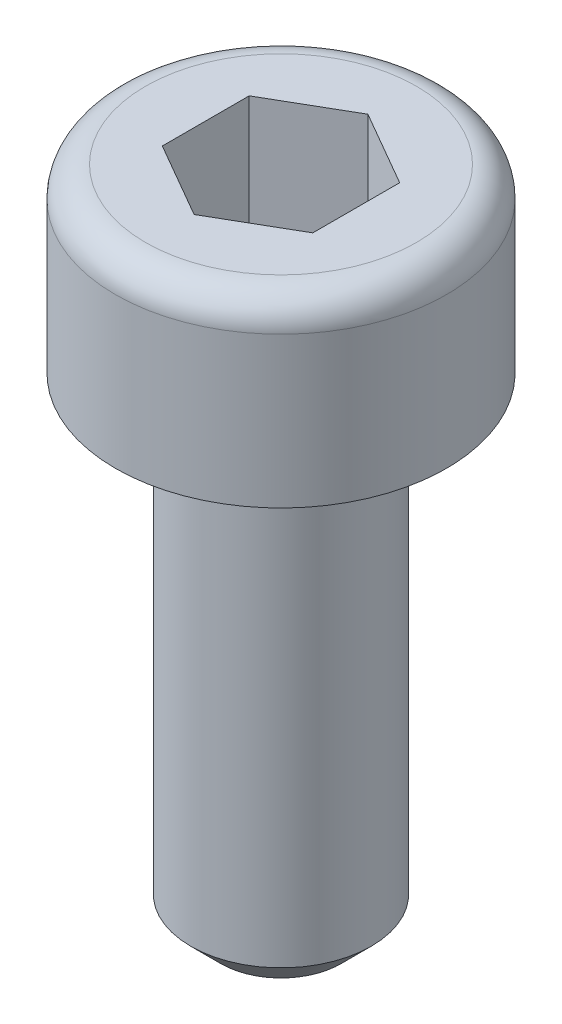
from build123d import *

# Parameters (mm, degrees)
CORTAR_EXTRUIR1_DEPTH = 2
CHAFL_N1_SIZE         = 0.5
REDONDEO1_R           = 0.5


with BuildPart() as part:
    # Croquis1 → Revolución1 (revolve)
    with BuildSketch(Plane.XY, mode=Mode.PRIVATE) as revoluci_n1_sk:
        Polygon((0, 0), (2.75, 0), (2.75, -3), (1.5, -3), (1.5, -11), (0, -11), align=None)
    revolve(revoluci_n1_sk.sketch.rotate(Axis((0, 0, 0), (0, -1, 0)), 90), axis=Axis((0, 0, 0), (0, -1, 0)))

    # Croquis2 → Cortar-Extruir1 (cut)
    with BuildSketch(Plane(origin=(0, 0, 0), x_dir=(1, 0, 0), z_dir=(0, 1, 0))):
        Polygon((1.25, 0.721687836), (0, 1.443375673), (-1.25, 0.721687836), (-1.25, -0.721687836), (0, -1.443375673), (1.25, -0.721687836), align=None)
    extrude(amount=-CORTAR_EXTRUIR1_DEPTH, mode=Mode.SUBTRACT)

    # Chaflán1
    chafl_n1_edges = [part.edges().sort_by_distance(p)[0] for p in [
        (0, -11, -1.5),
    ]]
    chamfer(chafl_n1_edges, length=CHAFL_N1_SIZE)

    # Redondeo1
    redondeo1_edges = [part.edges().sort_by_distance(p)[0] for p in [
        (0, 0, -2.75),
    ]]
    fillet(redondeo1_edges, radius=REDONDEO1_R)


solid = part.part
